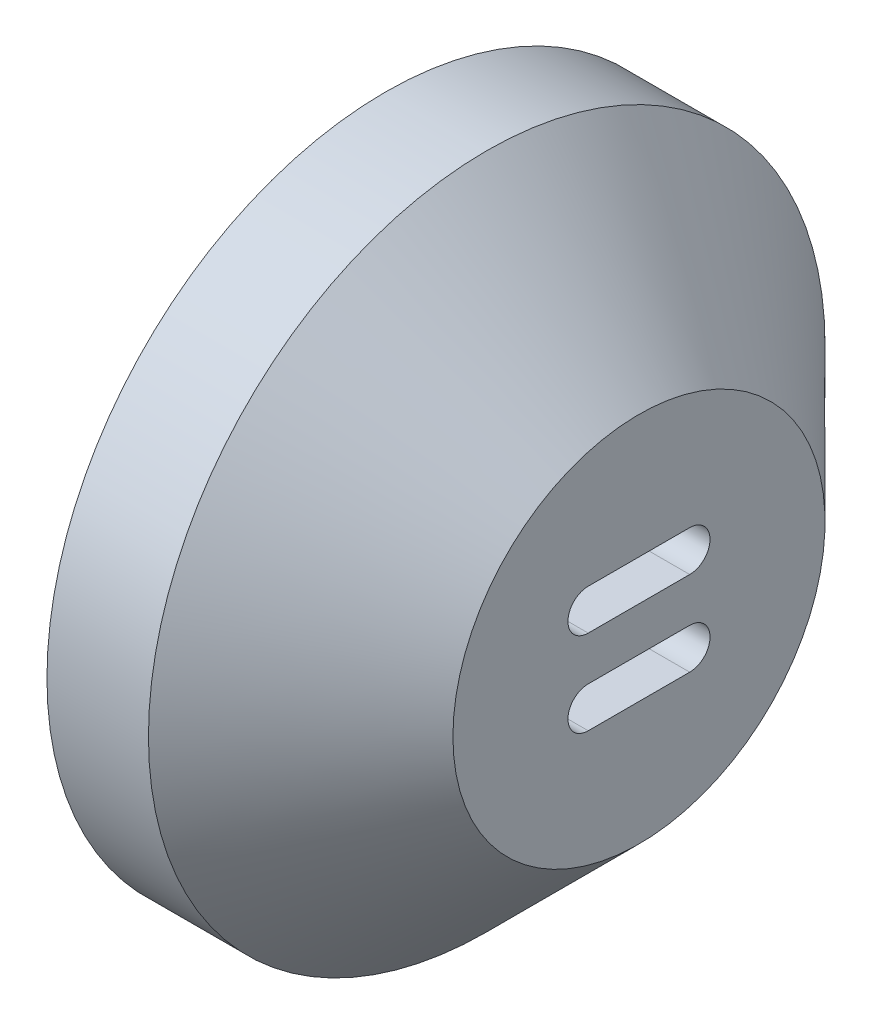
from build123d import *

# Parameters (mm, degrees)
CIRPATTERN_COUNT = 8
SLOT_CUT_DEPTH   = 196.79823157


with BuildPart() as part:
    # Sketch1 → Revolve 2 (revolve)
    with BuildSketch(Plane.XY, mode=Mode.PRIVATE) as revolve_2_sk:
        Polygon((0, 43.897637795), (30, 43.897637795), (75, -1.102362205), (75, -56.102362205), (63, -56.102362205), (63, -6.072924953), (25.029437252, 31.897637795), (0, 31.897637795), align=None)
    revolve(revolve_2_sk.sketch.rotate(Axis((63, -56.102362205, 0), (1, 0, 0)), 90), axis=Axis((63, -56.102362205, 0), (1, 0, 0)))

    # Sketch3 → M8x1.0 Tapped Hole (revolve, cut)
    with BuildSketch(Plane.ZX.offset(37.897637795)):
        Polygon((0, 0), (0, 23.103012167), (3.5, 21), (3.5, 0), align=None)
    m8x1_0_tapped_hole = revolve(axis=Axis((-6.35, 37.897637795, 0), (1, 0, 0)), mode=Mode.SUBTRACT)

    # CirPattern: M8x1.0 Tapped Hole ×8 about axis
    cirpattern_axis = Axis((0, -56.102362205, 0), (1, 0, 0))
    for i in range(1, CIRPATTERN_COUNT):
        add(m8x1_0_tapped_hole.rotate(cirpattern_axis, i * 360 / CIRPATTERN_COUNT), mode=Mode.SUBTRACT)

    # Sketch2 → Slot Cut (cut, through all)
    with BuildSketch(Plane.ZY.offset(-63)):
        with BuildLine():
            Line((-15, -37.602362205), (15, -37.602362205))
            ThreePointArc((15, -37.602362205), (21, -43.602362205), (15, -49.602362205))
            Line((15, -49.602362205), (-15, -49.602362205))
            ThreePointArc((-15, -49.602362205), (-21, -43.602362205), (-15, -37.602362205))
        make_face()
    slot_cut = extrude(amount=-SLOT_CUT_DEPTH, mode=Mode.SUBTRACT)

    # Mirror 2: Slot Cut across plane
    add(slot_cut.mirror(Plane.ZX.offset(-56.102362205)), mode=Mode.SUBTRACT)


solid = part.part
